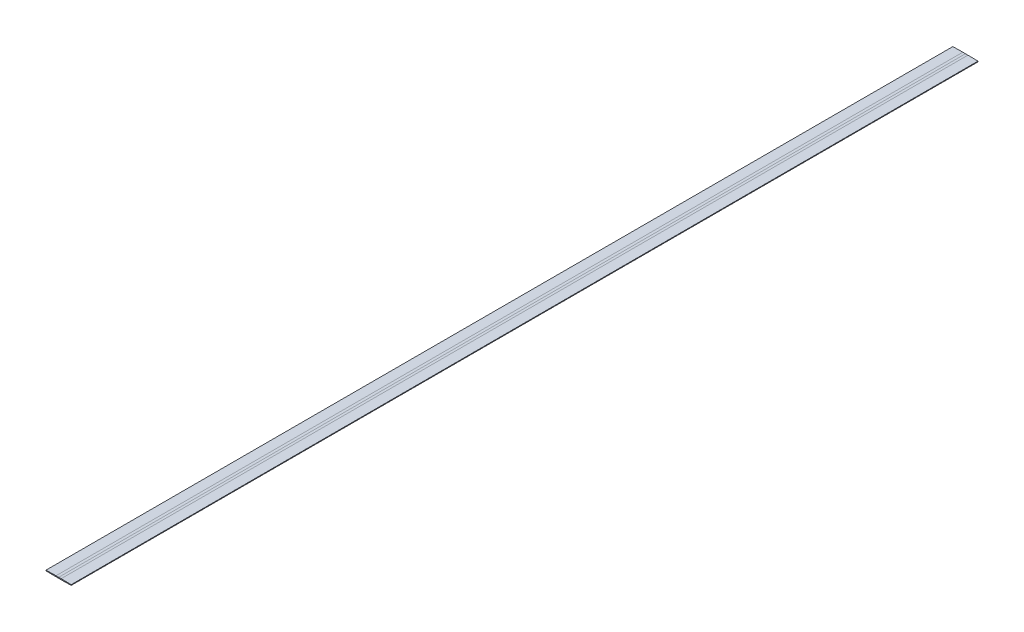
from build123d import *

# Parameters (mm, degrees)
EXTRUDE1_DEPTH       = 914.4
MIRROR2_COPY_1_DEPTH = 914.4


with BuildPart() as part:
    # Sketch1 → Extrude1 (new, symmetric)
    with BuildSketch(Plane.XY):
        Polygon((-25.4, -0.6604), (-5.159375, -0.9906), (0, -0.79375), (0, 0), (-25.4, 0), align=None)
    extrude1 = extrude(amount=EXTRUDE1_DEPTH, both=True)

    # Mirror1: Extrude1 across plane
    add(extrude1.mirror(Plane(origin=(0, 0, 0), x_dir=(0, 0, 1), z_dir=(1, 0, 0))))

    # Mirror2: Extrude1 across plane
    add(extrude1.mirror(Plane.ZX))

    # Mirror2 copy 1 sketch → Mirror2 copy 1 (add, symmetric)
    with BuildSketch(Plane(origin=(0, 0, 0), x_dir=(-1, 0, 0), z_dir=(0, 0, 1))):
        Polygon((-25.4, -0.6604), (-5.159375, -0.9906), (0, -0.79375), (0, 0), (-25.4, 0), align=None)
    extrude(amount=MIRROR2_COPY_1_DEPTH, both=True)


solid = part.part
